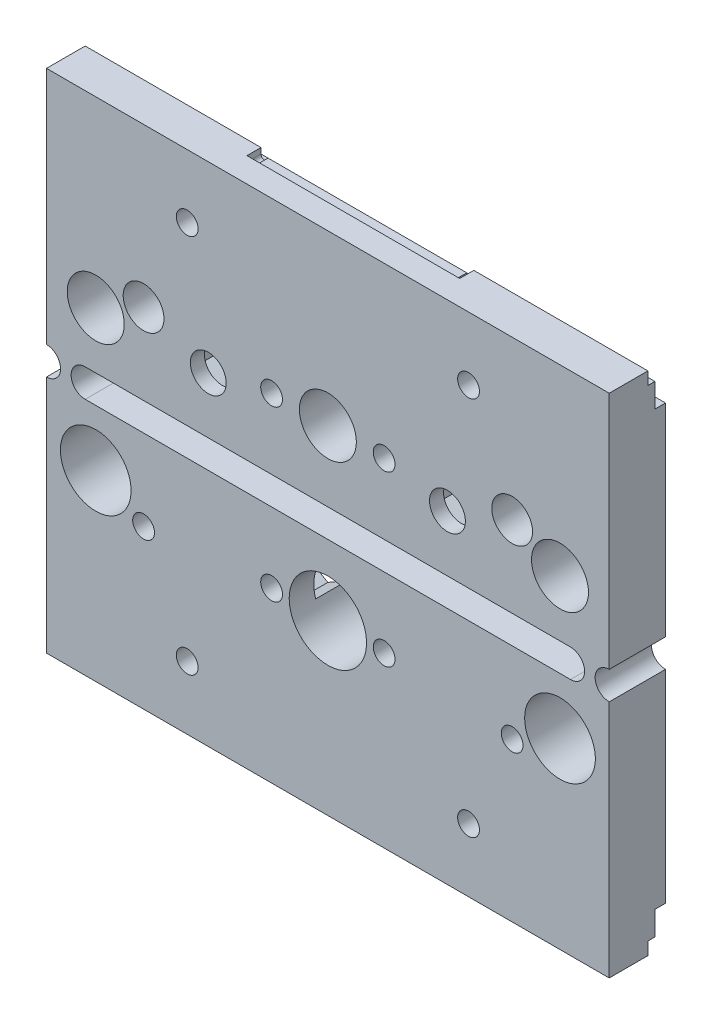
from build123d import *

# Parameters (mm, degrees)
SKETCH_2_W           = 80
SKETCH_2_H           = 34
SKETCH_2_R           = 4.05
EXTRUDE_1_DEPTH      = 8
SKETCH_3_R           = 2.55
CUT_EXTRUDE_1_DEPTH  = 88.292611371
CUT_EXTRUDE_2_DEPTH  = 88.292611371
SKETCH_5_R           = 1.55
CUT_EXTRUDE_3_DEPTH  = 88.292611371
CUT_EXTRUDE_5_DEPTH  = 4.5
SKETCH_25_R          = 1.55
CUT_EXTRUDE_13_DEPTH = 88.292611371
CUT_EXTRUDE_11_DEPTH = 2
EXTRUDE_2_DEPTH      = 8
SKETCH_26_R          = 5.025
CUT_EXTRUDE_14_DEPTH = 89.926936302
SKETCH_27_R          = 2.9
SKETCH_27_R_2        = 1.55
CUT_EXTRUDE_15_DEPTH = 89.926936302
CUT_EXTRUDE_16_DEPTH = 6
SKETCH_29_R          = 5.5
CUT_EXTRUDE_17_DEPTH = 89.926936302


with BuildPart() as part:
    # 草图2 → 凸台-拉伸1 (new body)
    with BuildSketch(Plane.XY):
        with Locations((40, 17)):
            Rectangle(SKETCH_2_W, SKETCH_2_H)
        with Locations((7, 8)):
            Circle(SKETCH_2_R, mode=Mode.SUBTRACT)
        with Locations((40, 10)):
            Circle(SKETCH_2_R, mode=Mode.SUBTRACT)
        with Locations((73, 8)):
            Circle(SKETCH_2_R, mode=Mode.SUBTRACT)
    extrude_1 = extrude(amount=EXTRUDE_1_DEPTH)

    # 草图3 → 切除-拉伸1 (cut, through all)
    with BuildSketch(Plane.XY.offset(8)):
        with Locations((23, 8)):
            Circle(SKETCH_3_R)
        with Locations((57, 8)):
            Circle(SKETCH_3_R)
    extrude(amount=-CUT_EXTRUDE_1_DEPTH, mode=Mode.SUBTRACT)

    # 草图4 → 切除-拉伸2 (cut, through all)
    with BuildSketch(Plane(origin=(80, 0, 0), x_dir=(0, 0, -1), z_dir=(1, 0, 0))):
        Polygon((-1.5, 32.2), (-2.5, 32.2), (-2.5, 34), (0, 34), (0, 28.8), (-1.5, 28.8), align=None)
    cut_extrude_2 = extrude(amount=-CUT_EXTRUDE_2_DEPTH, mode=Mode.SUBTRACT)

    # 草图5 → 切除-拉伸3 (cut, through all)
    with BuildSketch(Plane.XY.offset(8)):
        with Locations((48, 10)):
            Circle(SKETCH_5_R)
        with Locations((32, 10)):
            Circle(SKETCH_5_R)
    cut_extrude_3 = extrude(amount=-CUT_EXTRUDE_3_DEPTH, mode=Mode.SUBTRACT)

    # 草图8 → 切除-拉伸5 (cut)
    with BuildSketch(Plane(origin=(0, 0, 0), x_dir=(-1, 0, 0), z_dir=(0, 0, -1))):
        Polygon((-45.15, 8.354551733), (-45.15, 11.645448267), (-48, 13.290896534), (-50.85, 11.645448267), (-50.85, 8.354551733), (-48, 6.709103466), align=None)
        Polygon((-29.15, 8.354551733), (-29.15, 11.645448267), (-32, 13.290896534), (-34.85, 11.645448267), (-34.85, 8.354551733), (-32, 6.709103466), align=None)
    cut_extrude_5 = extrude(amount=-CUT_EXTRUDE_5_DEPTH, mode=Mode.SUBTRACT)

    # 草图25 → 切除-拉伸13 (cut, through all)
    with BuildSketch(Plane(origin=(0, 0, 0), x_dir=(-1, 0, 0), z_dir=(0, 0, -1))):
        with Locations((-60, 25)):
            Circle(SKETCH_25_R)
        with Locations((-20, 25)):
            Circle(SKETCH_25_R)
    cut_extrude_13 = extrude(amount=-CUT_EXTRUDE_13_DEPTH, mode=Mode.SUBTRACT)

    # 草图19 → 切除-拉伸11 (cut)
    with BuildSketch(Plane(origin=(0, 0, 2.5), x_dir=(-1, 0, 0), z_dir=(0, 0, -1))):
        with BuildLine():
            Line((-25, 34), (-55.247938178, 34))
            Line((-55.247938178, 34), (-55.247938178, 33.2))
            ThreePointArc((-55.247938178, 33.2), (-54.747938178, 32.7), (-54.247938178, 33.2))
            Line((-54.247938178, 33.2), (-26, 33.2))
            ThreePointArc((-26, 33.2), (-25.5, 32.7), (-25, 33.2))
            Line((-25, 33.2), (-25, 34))
        make_face()
    cut_extrude_11 = extrude(amount=-CUT_EXTRUDE_11_DEPTH, mode=Mode.SUBTRACT)

    # 草图22 → 凸台-拉伸2 (add)
    with BuildSketch(Plane.XY.offset(8)):
        with BuildLine():
            Line((0, -4), (5.5, -4))
            ThreePointArc((5.5, -4), (3.5, -2), (5.5, 0))
            Line((5.5, 0), (0, 0))
            ThreePointArc((0, 0), (2, -2), (0, -4))
        make_face()
        with BuildLine():
            Line((80, 0), (74.5, 0))
            ThreePointArc((74.5, 0), (76.5, -2), (74.5, -4))
            Line((74.5, -4), (80, -4))
            ThreePointArc((80, -4), (78, -2), (80, 0))
        make_face()
    extrude(amount=-EXTRUDE_2_DEPTH)

    # 镜向2: 凸台-拉伸1, 切除-拉伸2, 切除-拉伸3, 切除-拉伸5, 切除-拉伸13, 切除-拉伸11 across plane
    add(extrude_1.mirror(Plane(origin=(0, -2, 0), x_dir=(0, 0, 1), z_dir=(0, -1, 0))))
    add(cut_extrude_2.mirror(Plane(origin=(0, -2, 0), x_dir=(0, 0, 1), z_dir=(0, -1, 0))), mode=Mode.SUBTRACT)
    add(cut_extrude_3.mirror(Plane(origin=(0, -2, 0), x_dir=(0, 0, 1), z_dir=(0, -1, 0))), mode=Mode.SUBTRACT)
    add(cut_extrude_5.mirror(Plane(origin=(0, -2, 0), x_dir=(0, 0, 1), z_dir=(0, -1, 0))), mode=Mode.SUBTRACT)
    add(cut_extrude_13.mirror(Plane(origin=(0, -2, 0), x_dir=(0, 0, 1), z_dir=(0, -1, 0))), mode=Mode.SUBTRACT)
    add(cut_extrude_11.mirror(Plane(origin=(0, -2, 0), x_dir=(0, 0, 1), z_dir=(0, -1, 0))), mode=Mode.SUBTRACT)

    # 草图26 → 切除-拉伸14 (cut, through all)
    with BuildSketch(Plane(origin=(0, 0, 0), x_dir=(-1, 0, 0), z_dir=(0, 0, -1))):
        with Locations((-73, -12)):
            Circle(SKETCH_26_R)
        with Locations((-7, -12)):
            Circle(SKETCH_26_R)
    extrude(amount=-CUT_EXTRUDE_14_DEPTH, mode=Mode.SUBTRACT)

    # 草图27 → 切除-拉伸15 (cut, through all)
    with BuildSketch(Plane(origin=(0, 0, 0), x_dir=(-1, 0, 0), z_dir=(0, 0, -1))):
        with Locations((-66.2, 11.5)):
            Circle(SKETCH_27_R)
        with Locations((-66.2, -15.5)):
            Circle(SKETCH_27_R_2)
        with Locations((-13.8, -15.5)):
            Circle(SKETCH_27_R_2)
        with Locations((-13.8, 11.5)):
            Circle(SKETCH_27_R)
    extrude(amount=-CUT_EXTRUDE_15_DEPTH, mode=Mode.SUBTRACT)

    # 草图28 → 切除-拉伸16 (cut)
    with BuildSketch(Plane(origin=(0, 0, 0), x_dir=(-1, 0, 0), z_dir=(0, 0, -1))):
        Polygon((-52.9, 5.632863896), (-52.9, 10.367136104), (-57, 12.734272207), (-61.1, 10.367136104), (-61.1, 5.632863896), (-57, 3.265727793), align=None)
        Polygon((-18.9, 5.632863896), (-18.9, 10.367136104), (-23, 12.734272207), (-27.1, 10.367136104), (-27.1, 5.632863896), (-23, 3.265727793), align=None)
    extrude(amount=-CUT_EXTRUDE_16_DEPTH, mode=Mode.SUBTRACT)

    # 草图29 → 切除-拉伸17 (cut, through all)
    with BuildSketch(Plane(origin=(0, 0, 0), x_dir=(-1, 0, 0), z_dir=(0, 0, -1))):
        with Locations((-40, -14)):
            Circle(SKETCH_29_R)
    extrude(amount=-CUT_EXTRUDE_17_DEPTH, mode=Mode.SUBTRACT)


solid = part.part
